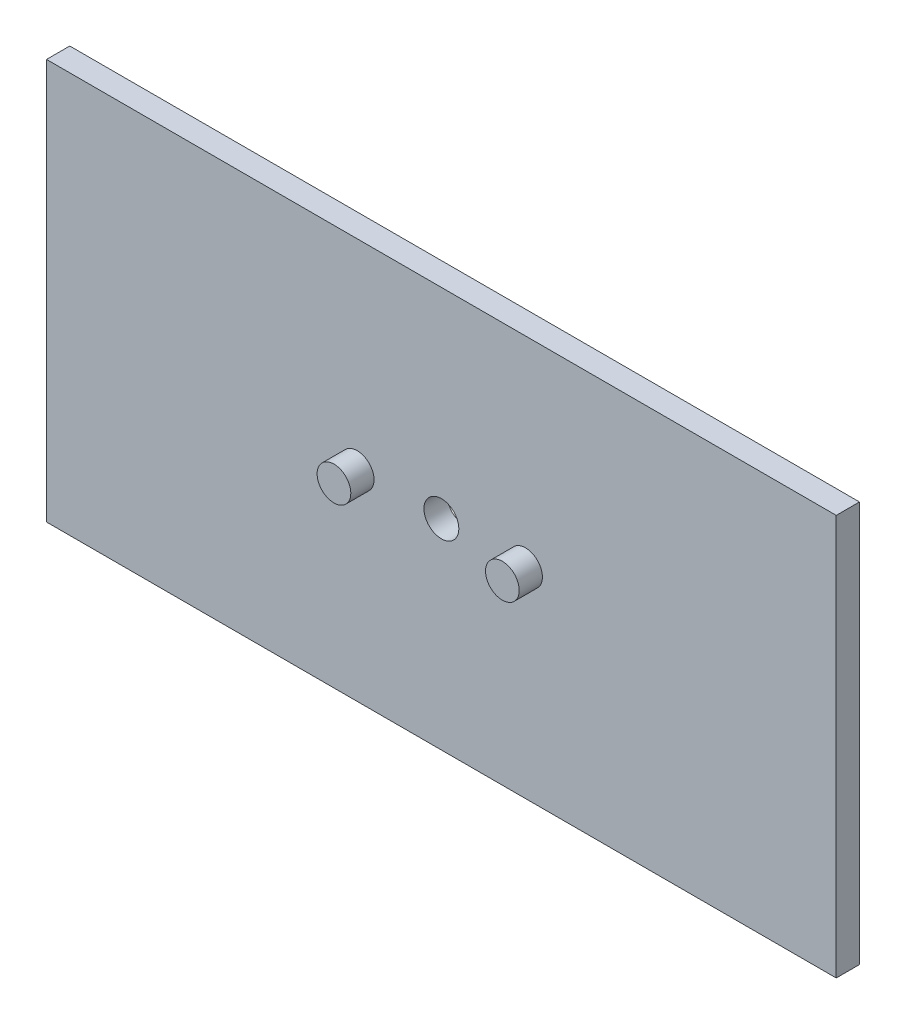
from build123d import *

# Parameters (mm, degrees)
SKETCH1_W           = 68
SKETCH1_H           = 34.5
BOSS_EXTRUDE1_DEPTH = 2
SKETCH2_R           = 1.45
BOSS_EXTRUDE2_DEPTH = 2
SKETCH3_R           = 1.5
CUT_EXTRUDE1_DEPTH  = 39.17803688


with BuildPart() as part:
    # Sketch1 → Boss-Extrude1 (new body)
    with BuildSketch(Plane.XY):
        Rectangle(SKETCH1_W, SKETCH1_H)
    extrude(amount=BOSS_EXTRUDE1_DEPTH)

    # Sketch2 → Boss-Extrude2 (add)
    with BuildSketch(Plane.XY.offset(2)):
        with Locations(Location((-7.25, 0, 0), (0, 0, 180))):
            Circle(SKETCH2_R)
        with Locations(Location((7.25, 0, 0), (0, 0, 180))):
            Circle(SKETCH2_R)
    extrude(amount=BOSS_EXTRUDE2_DEPTH)

    # Sketch3 → Cut-Extrude1 (cut, through all)
    with BuildSketch(Plane.XY.offset(2)):
        Circle(SKETCH3_R)
    extrude(amount=-CUT_EXTRUDE1_DEPTH, mode=Mode.SUBTRACT)


solid = part.part
